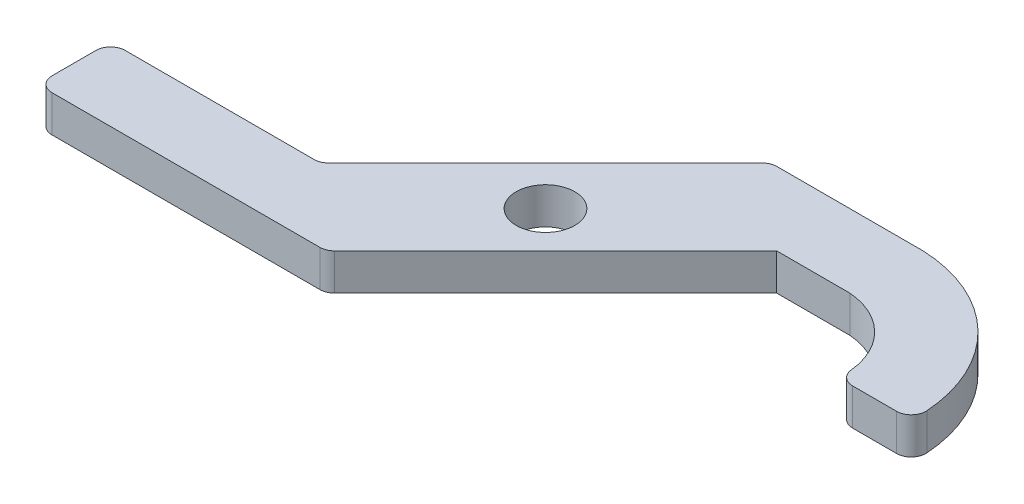
from build123d import *

# Parameters (mm, degrees)
SKETCH1_R           = 5.08
BOSS_EXTRUDE1_DEPTH = 6.35


with BuildPart() as part:
    # Sketch1 → Boss-Extrude1 (new body)
    with BuildSketch(Plane(origin=(0, 0, 0), x_dir=(1, 0, 0), z_dir=(0, 1, 0))):
        with BuildLine():
            Line((-11.956051224, 0.073941191), (26.403889176, 38.433881591))
            Line((26.403889176, 38.433881591), (39.103889176, 38.433881591))
            ThreePointArc((39.103889176, 38.433881591), (47.009448875, 34.839896868), (50.775072277, 27.014637718))
            ThreePointArc((50.775072277, 27.014637718), (51.59882499, 25.385821387), (53.302203848, 24.729992415))
            Line((53.302203848, 24.729992415), (60.928206609, 24.729992415))
            ThreePointArc((60.928206609, 24.729992415), (62.783570301, 25.53528046), (63.462475569, 27.440523463))
            ThreePointArc((63.462475569, 27.440523463), (55.823997921, 43.955508609), (39.103889176, 51.133881591))
            Line((39.103889176, 51.133881591), (13.752102448, 51.133881591))
            ThreePointArc((13.752102448, 51.133881591), (12.78008653, 50.940535604), (11.956051224, 50.389932815))
            Line((11.956051224, 50.389932815), (-25.6599404, 12.773941191))
            ThreePointArc((-25.6599404, 12.773941191), (-26.483975706, 12.223338403), (-27.455991624, 12.029992415))
            Line((-27.455991624, 12.029992415), (-60.230604195, 12.029992415))
            ThreePointArc((-60.230604195, 12.029992415), (-62.026655419, 11.28604364), (-62.770604195, 9.489992415))
            Line((-62.770604195, 9.489992415), (-62.770604195, 1.869992415))
            ThreePointArc((-62.770604195, 1.869992415), (-62.026655419, 0.073941191), (-60.230604195, -0.670007585))
            Line((-60.230604195, -0.670007585), (-13.752102448, -0.670007585))
            ThreePointArc((-13.752102448, -0.670007585), (-12.78008653, -0.476661597), (-11.956051224, 0.073941191))
        make_face()
        with Locations(Location((0, 24.729992415, 0), (0, 0, 270))):
            Circle(SKETCH1_R, mode=Mode.SUBTRACT)
    extrude(amount=BOSS_EXTRUDE1_DEPTH)


solid = part.part
